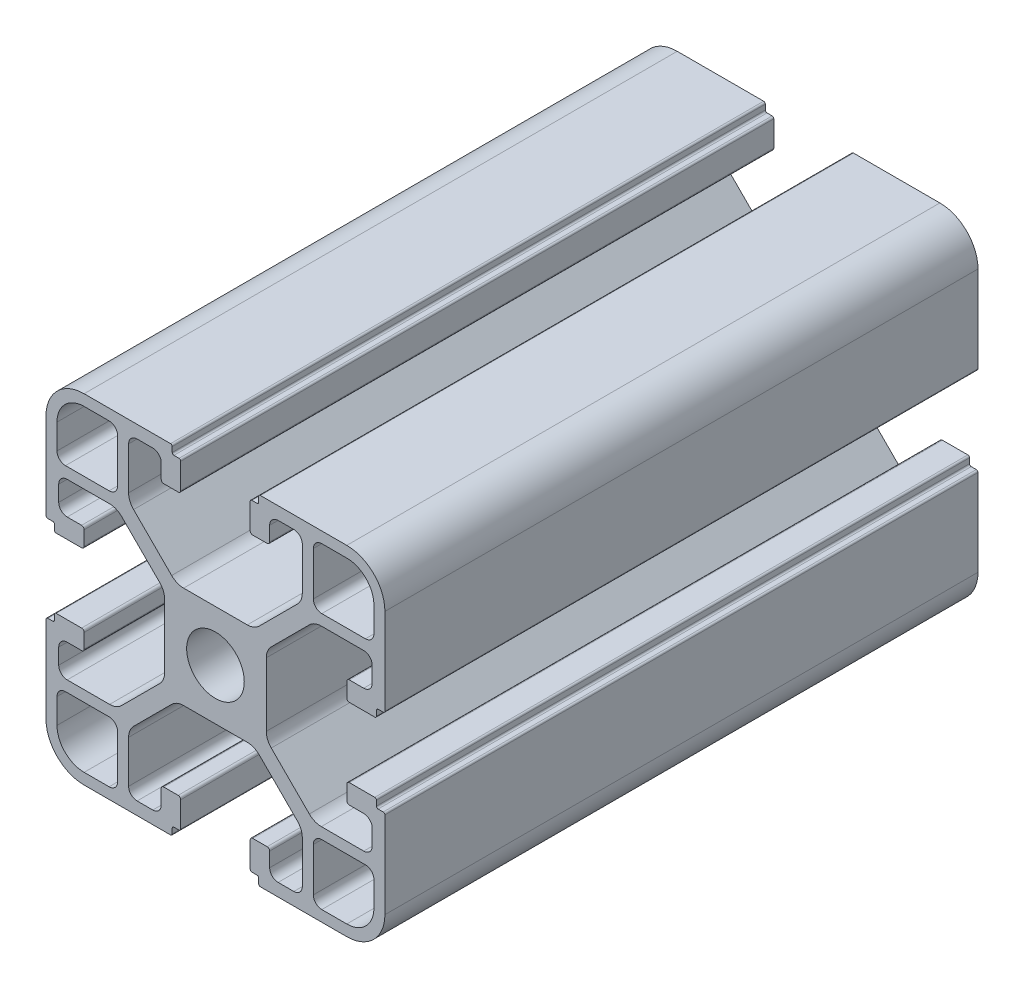
from build123d import *

# Parameters (mm, degrees)
SKETCH2_R           = 3.4
BOSS_EXTRUDE1_DEPTH = 70


with BuildPart() as part:
    # Sketch2 → Boss-Extrude1 (new body)
    with BuildSketch(Plane.XY):
        with BuildLine():
            Line((4.5, 0), (14.7, 0))
            ThreePointArc((14.7, 0), (14.841421356, 0.058578644), (14.9, 0.2))
            Line((14.9, 0.2), (14.9, 0.8))
            ThreePointArc((14.9, 0.8), (14.958578644, 0.941421356), (15.1, 1))
            Line((15.1, 1), (15.7, 1))
            ThreePointArc((15.7, 1), (15.841421356, 1.058578644), (15.9, 1.2))
            Line((15.9, 1.2), (15.9, 4.2))
            ThreePointArc((15.9, 4.2), (15.812132034, 4.412132034), (15.6, 4.5))
            Line((15.6, 4.5), (13.9, 4.5))
            ThreePointArc((13.9, 4.5), (13.687867966, 4.412132034), (13.6, 4.2))
            Line((13.6, 4.2), (13.6, 2.5))
            ThreePointArc((13.6, 2.5), (13.307106781, 1.792893219), (12.6, 1.5))
            Line((12.6, 1.5), (10.75, 1.5))
            ThreePointArc((10.75, 1.5), (10.042893219, 1.792893219), (9.75, 2.5))
            Line((9.75, 2.5), (9.75, 7.507359313))
            ThreePointArc((9.75, 7.507359313), (9.902240935, 8.272726178), (10.335786438, 8.921572875))
            Line((10.335786438, 8.921572875), (14.828427125, 13.414213562))
            ThreePointArc((14.828427125, 13.414213562), (15.477273822, 13.847759065), (16.242640687, 14))
            Line((16.242640687, 14), (23.757359313, 14))
            ThreePointArc((23.757359313, 14), (24.522726178, 13.847759065), (25.171572875, 13.414213562))
            Line((25.171572875, 13.414213562), (29.664213562, 8.921572875))
            ThreePointArc((29.664213562, 8.921572875), (30.097759065, 8.272726178), (30.25, 7.507359313))
            Line((30.25, 7.507359313), (30.25, 2.5))
            ThreePointArc((30.25, 2.5), (29.957106781, 1.792893219), (29.25, 1.5))
            Line((29.25, 1.5), (27.4, 1.5))
            ThreePointArc((27.4, 1.5), (26.692893219, 1.792893219), (26.4, 2.5))
            Line((26.4, 2.5), (26.4, 4.2))
            ThreePointArc((26.4, 4.2), (26.312132034, 4.412132034), (26.1, 4.5))
            Line((26.1, 4.5), (24.4, 4.5))
            ThreePointArc((24.4, 4.5), (24.187867966, 4.412132034), (24.1, 4.2))
            Line((24.1, 4.2), (24.1, 1.2))
            ThreePointArc((24.1, 1.2), (24.158578644, 1.058578644), (24.3, 1))
            Line((24.3, 1), (24.9, 1))
            ThreePointArc((24.9, 1), (25.041421356, 0.941421356), (25.1, 0.8))
            Line((25.1, 0.8), (25.1, 0.2))
            ThreePointArc((25.1, 0.2), (25.158578644, 0.058578644), (25.3, 0))
            Line((25.3, 0), (35.5, 0))
            ThreePointArc((35.5, 0), (38.681980515, 1.318019485), (40, 4.5))
            Line((40, 4.5), (40, 14.7))
            ThreePointArc((40, 14.7), (39.941421356, 14.841421356), (39.8, 14.9))
            Line((39.8, 14.9), (39.2, 14.9))
            ThreePointArc((39.2, 14.9), (39.058578644, 14.958578644), (39, 15.1))
            Line((39, 15.1), (39, 15.7))
            ThreePointArc((39, 15.7), (38.941421356, 15.841421356), (38.8, 15.9))
            Line((38.8, 15.9), (35.8, 15.9))
            ThreePointArc((35.8, 15.9), (35.587867966, 15.812132034), (35.5, 15.6))
            Line((35.5, 15.6), (35.5, 13.9))
            ThreePointArc((35.5, 13.9), (35.587867966, 13.687867966), (35.8, 13.6))
            Line((35.8, 13.6), (37.5, 13.6))
            ThreePointArc((37.5, 13.6), (38.207106781, 13.307106781), (38.5, 12.6))
            Line((38.5, 12.6), (38.5, 10.75))
            ThreePointArc((38.5, 10.75), (38.207106781, 10.042893219), (37.5, 9.75))
            Line((37.5, 9.75), (32.492640687, 9.75))
            ThreePointArc((32.492640687, 9.75), (31.727273822, 9.902240935), (31.078427125, 10.335786438))
            Line((31.078427125, 10.335786438), (26.585786438, 14.828427125))
            ThreePointArc((26.585786438, 14.828427125), (26.152240935, 15.477273822), (26, 16.242640687))
            Line((26, 16.242640687), (26, 23.757359313))
            ThreePointArc((26, 23.757359313), (26.152240935, 24.522726178), (26.585786438, 25.171572875))
            Line((26.585786438, 25.171572875), (31.078427125, 29.664213562))
            ThreePointArc((31.078427125, 29.664213562), (31.727273822, 30.097759065), (32.492640687, 30.25))
            Line((32.492640687, 30.25), (37.5, 30.25))
            ThreePointArc((37.5, 30.25), (38.207106781, 29.957106781), (38.5, 29.25))
            Line((38.5, 29.25), (38.5, 27.4))
            ThreePointArc((38.5, 27.4), (38.207106781, 26.692893219), (37.5, 26.4))
            Line((37.5, 26.4), (35.8, 26.4))
            ThreePointArc((35.8, 26.4), (35.587867966, 26.312132034), (35.5, 26.1))
            Line((35.5, 26.1), (35.5, 24.4))
            ThreePointArc((35.5, 24.4), (35.587867966, 24.187867966), (35.8, 24.1))
            Line((35.8, 24.1), (38.8, 24.1))
            ThreePointArc((38.8, 24.1), (38.941421356, 24.158578644), (39, 24.3))
            Line((39, 24.3), (39, 24.9))
            ThreePointArc((39, 24.9), (39.058578644, 25.041421356), (39.2, 25.1))
            Line((39.2, 25.1), (39.8, 25.1))
            ThreePointArc((39.8, 25.1), (39.941421356, 25.158578644), (40, 25.3))
            Line((40, 25.3), (40, 35.5))
            ThreePointArc((40, 35.5), (38.681980515, 38.681980515), (35.5, 40))
            Line((35.5, 40), (25.3, 40))
            ThreePointArc((25.3, 40), (25.158578644, 39.941421356), (25.1, 39.8))
            Line((25.1, 39.8), (25.1, 39.2))
            ThreePointArc((25.1, 39.2), (25.041421356, 39.058578644), (24.9, 39))
            Line((24.9, 39), (24.3, 39))
            ThreePointArc((24.3, 39), (24.158578644, 38.941421356), (24.1, 38.8))
            Line((24.1, 38.8), (24.1, 35.8))
            ThreePointArc((24.1, 35.8), (24.187867966, 35.587867966), (24.4, 35.5))
            Line((24.4, 35.5), (26.1, 35.5))
            ThreePointArc((26.1, 35.5), (26.312132034, 35.587867966), (26.4, 35.8))
            Line((26.4, 35.8), (26.4, 37.5))
            ThreePointArc((26.4, 37.5), (26.692893219, 38.207106781), (27.4, 38.5))
            Line((27.4, 38.5), (29.25, 38.5))
            ThreePointArc((29.25, 38.5), (29.957106781, 38.207106781), (30.25, 37.5))
            Line((30.25, 37.5), (30.25, 32.492640687))
            ThreePointArc((30.25, 32.492640687), (30.097759065, 31.727273822), (29.664213562, 31.078427125))
            Line((29.664213562, 31.078427125), (25.171572875, 26.585786438))
            ThreePointArc((25.171572875, 26.585786438), (24.522726178, 26.152240935), (23.757359313, 26))
            Line((23.757359313, 26), (16.242640687, 26))
            ThreePointArc((16.242640687, 26), (15.477273822, 26.152240935), (14.828427125, 26.585786438))
            Line((14.828427125, 26.585786438), (10.335786438, 31.078427125))
            ThreePointArc((10.335786438, 31.078427125), (9.902240935, 31.727273822), (9.75, 32.492640687))
            Line((9.75, 32.492640687), (9.75, 37.5))
            ThreePointArc((9.75, 37.5), (10.042893219, 38.207106781), (10.75, 38.5))
            Line((10.75, 38.5), (12.6, 38.5))
            ThreePointArc((12.6, 38.5), (13.307106781, 38.207106781), (13.6, 37.5))
            Line((13.6, 37.5), (13.6, 35.8))
            ThreePointArc((13.6, 35.8), (13.687867966, 35.587867966), (13.9, 35.5))
            Line((13.9, 35.5), (15.6, 35.5))
            ThreePointArc((15.6, 35.5), (15.812132034, 35.587867966), (15.9, 35.8))
            Line((15.9, 35.8), (15.9, 38.8))
            ThreePointArc((15.9, 38.8), (15.841421356, 38.941421356), (15.7, 39))
            Line((15.7, 39), (15.1, 39))
            ThreePointArc((15.1, 39), (14.958578644, 39.058578644), (14.9, 39.2))
            Line((14.9, 39.2), (14.9, 39.8))
            ThreePointArc((14.9, 39.8), (14.841421356, 39.941421356), (14.7, 40))
            Line((14.7, 40), (4.5, 40))
            ThreePointArc((4.5, 40), (1.318019485, 38.681980515), (0, 35.5))
            Line((0, 35.5), (0, 25.3))
            ThreePointArc((0, 25.3), (0.058578644, 25.158578644), (0.2, 25.1))
            Line((0.2, 25.1), (0.8, 25.1))
            ThreePointArc((0.8, 25.1), (0.941421356, 25.041421356), (1, 24.9))
            Line((1, 24.9), (1, 24.3))
            ThreePointArc((1, 24.3), (1.058578644, 24.158578644), (1.2, 24.1))
            Line((1.2, 24.1), (4.2, 24.1))
            ThreePointArc((4.2, 24.1), (4.412132034, 24.187867966), (4.5, 24.4))
            Line((4.5, 24.4), (4.5, 26.1))
            ThreePointArc((4.5, 26.1), (4.412132034, 26.312132034), (4.2, 26.4))
            Line((4.2, 26.4), (2.5, 26.4))
            ThreePointArc((2.5, 26.4), (1.792893219, 26.692893219), (1.5, 27.4))
            Line((1.5, 27.4), (1.5, 29.25))
            ThreePointArc((1.5, 29.25), (1.792893219, 29.957106781), (2.5, 30.25))
            Line((2.5, 30.25), (7.507359313, 30.25))
            ThreePointArc((7.507359313, 30.25), (8.272726178, 30.097759065), (8.921572875, 29.664213562))
            Line((8.921572875, 29.664213562), (13.414213562, 25.171572875))
            ThreePointArc((13.414213562, 25.171572875), (13.847759065, 24.522726178), (14, 23.757359313))
            Line((14, 23.757359313), (14, 16.242640687))
            ThreePointArc((14, 16.242640687), (13.847759065, 15.477273822), (13.414213562, 14.828427125))
            Line((13.414213562, 14.828427125), (8.921572875, 10.335786438))
            ThreePointArc((8.921572875, 10.335786438), (8.272726178, 9.902240935), (7.507359313, 9.75))
            Line((7.507359313, 9.75), (2.5, 9.75))
            ThreePointArc((2.5, 9.75), (1.792893219, 10.042893219), (1.5, 10.75))
            Line((1.5, 10.75), (1.5, 12.6))
            ThreePointArc((1.5, 12.6), (1.792893219, 13.307106781), (2.5, 13.6))
            Line((2.5, 13.6), (4.2, 13.6))
            ThreePointArc((4.2, 13.6), (4.412132034, 13.687867966), (4.5, 13.9))
            Line((4.5, 13.9), (4.5, 15.6))
            ThreePointArc((4.5, 15.6), (4.412132034, 15.812132034), (4.2, 15.9))
            Line((4.2, 15.9), (1.2, 15.9))
            ThreePointArc((1.2, 15.9), (1.058578644, 15.841421356), (1, 15.7))
            Line((1, 15.7), (1, 15.1))
            ThreePointArc((1, 15.1), (0.941421356, 14.958578644), (0.8, 14.9))
            Line((0.8, 14.9), (0.2, 14.9))
            ThreePointArc((0.2, 14.9), (0.058578644, 14.841421356), (0, 14.7))
            Line((0, 14.7), (0, 4.5))
            ThreePointArc((0, 4.5), (1.318019485, 1.318019485), (4.5, 0))
        make_face()
        with Locations((20, 20)):
            Circle(SKETCH2_R, mode=Mode.SUBTRACT)
        with BuildLine():
            Line((31.55, 37.7), (31.55, 32.55))
            ThreePointArc((31.55, 32.55), (31.842893219, 31.842893219), (32.55, 31.55))
            Line((32.55, 31.55), (37.7, 31.55))
            ThreePointArc((37.7, 31.55), (38.407106781, 31.842893219), (38.7, 32.55))
            Line((38.7, 32.55), (38.7, 35.5))
            ThreePointArc((38.7, 35.5), (37.7627417, 37.7627417), (35.5, 38.7))
            Line((35.5, 38.7), (32.55, 38.7))
            ThreePointArc((32.55, 38.7), (31.842893219, 38.407106781), (31.55, 37.7))
        make_face(mode=Mode.SUBTRACT)
        with BuildLine():
            Line((1.3, 35.5), (1.3, 32.55))
            ThreePointArc((1.3, 32.55), (1.592893219, 31.842893219), (2.3, 31.55))
            Line((2.3, 31.55), (7.45, 31.55))
            ThreePointArc((7.45, 31.55), (8.157106781, 31.842893219), (8.45, 32.55))
            Line((8.45, 32.55), (8.45, 37.7))
            ThreePointArc((8.45, 37.7), (8.157106781, 38.407106781), (7.45, 38.7))
            Line((7.45, 38.7), (4.5, 38.7))
            ThreePointArc((4.5, 38.7), (2.2372583, 37.7627417), (1.3, 35.5))
        make_face(mode=Mode.SUBTRACT)
        with BuildLine():
            Line((1.3, 7.45), (1.3, 4.5))
            ThreePointArc((1.3, 4.5), (2.2372583, 2.2372583), (4.5, 1.3))
            Line((4.5, 1.3), (7.45, 1.3))
            ThreePointArc((7.45, 1.3), (8.157106781, 1.592893219), (8.45, 2.3))
            Line((8.45, 2.3), (8.45, 7.45))
            ThreePointArc((8.45, 7.45), (8.157106781, 8.157106781), (7.45, 8.45))
            Line((7.45, 8.45), (2.3, 8.45))
            ThreePointArc((2.3, 8.45), (1.592893219, 8.157106781), (1.3, 7.45))
        make_face(mode=Mode.SUBTRACT)
        with BuildLine():
            Line((31.55, 7.45), (31.55, 2.3))
            ThreePointArc((31.55, 2.3), (31.842893219, 1.592893219), (32.55, 1.3))
            Line((32.55, 1.3), (35.5, 1.3))
            ThreePointArc((35.5, 1.3), (37.7627417, 2.2372583), (38.7, 4.5))
            Line((38.7, 4.5), (38.7, 7.45))
            ThreePointArc((38.7, 7.45), (38.407106781, 8.157106781), (37.7, 8.45))
            Line((37.7, 8.45), (32.55, 8.45))
            ThreePointArc((32.55, 8.45), (31.842893219, 8.157106781), (31.55, 7.45))
        make_face(mode=Mode.SUBTRACT)
    extrude(amount=BOSS_EXTRUDE1_DEPTH)


solid = part.part
